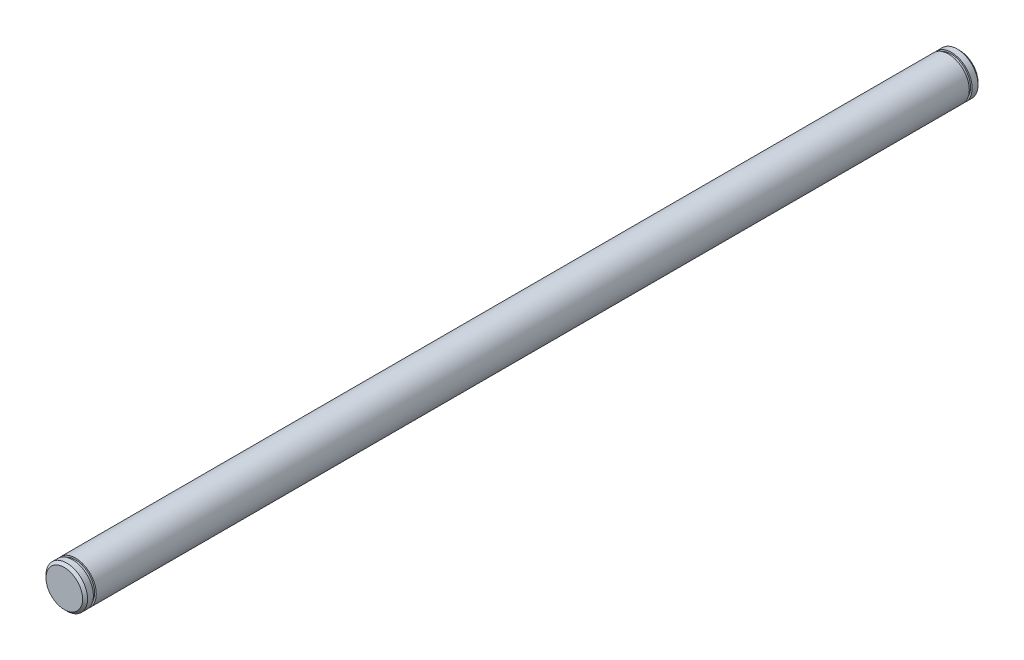
from build123d import *

# Parameters (mm, degrees)
SKETCH1_R                = 6.35
BOSS_EXTRUDE1_DEPTH      = 133.4008
SKETCH2_R                = 5.8547
BOSS_EXTRUDE2_DEPTH      = 0.889
BOSS_EXTRUDE3_START      = 2.54
SKETCH3_R                = 6.35
BOSS_EXTRUDE3_DEPTH      = 2.54
CHAMFER1_SIZE            = 0.762
CHAMFER1_OF_MIRROR1_SIZE = 0.762


with BuildPart() as part:
    # Sketch1 → Boss-Extrude1 (new, symmetric)
    with BuildSketch(Plane.XY):
        Circle(SKETCH1_R)
    extrude(amount=BOSS_EXTRUDE1_DEPTH, both=True)

    # Sketch2 → Boss-Extrude2 (add)
    with BuildSketch(Plane.XY.offset(133.4008)):
        Circle(SKETCH2_R)
    boss_extrude2 = extrude(amount=BOSS_EXTRUDE2_DEPTH)

    # Sketch3 → Boss-Extrude3 (add)
    with BuildSketch(Plane.XY.offset(134.2898).offset(BOSS_EXTRUDE3_START)):
        Circle(SKETCH3_R)
    boss_extrude3 = extrude(amount=-BOSS_EXTRUDE3_DEPTH)

    # Chamfer1
    chamfer1_edges = [part.edges().sort_by_distance(p)[0] for p in [
        (-6.35, 0, 136.8298),
    ]]
    chamfer(chamfer1_edges, length=CHAMFER1_SIZE)

    # Mirror1: Boss-Extrude2, Boss-Extrude3 across plane
    add(boss_extrude2.mirror(Plane.XY))
    add(boss_extrude3.mirror(Plane.XY))

    # Chamfer1 of Mirror1
    chamfer1_of_mirror1_edges = [part.edges().sort_by_distance(p)[0] for p in [
        (-6.35, 0, -136.8298),
    ]]
    chamfer(chamfer1_of_mirror1_edges, length=CHAMFER1_OF_MIRROR1_SIZE)


solid = part.part
